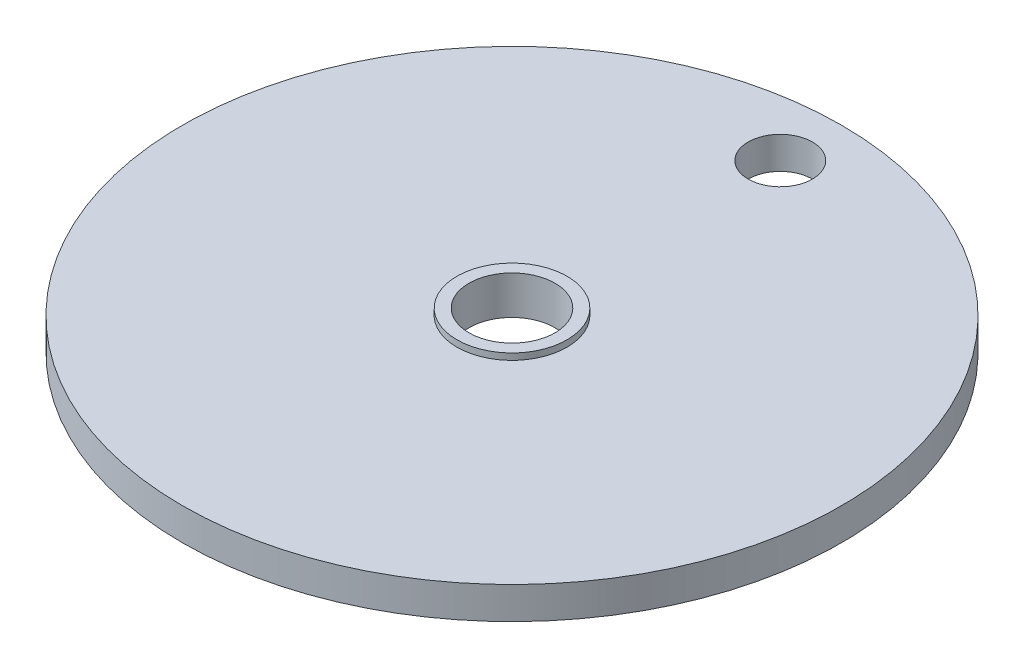
from build123d import *

# Parameters (mm, degrees)
SKETCH1_R           = 20.5
BOSS_EXTRUDE1_DEPTH = 2
SKETCH2_R           = 2.675
CUT_EXTRUDE1_DEPTH  = 2
BOSS_EXTRUDE2_START = 0.4
SKETCH3_R           = 3.425
SKETCH3_R_2         = 2.675
BOSS_EXTRUDE2_DEPTH = 0.4
SKETCH4_R           = 2
CUT_EXTRUDE2_DEPTH  = 2


with BuildPart() as part:
    # Sketch1 → Boss-Extrude1 (new body)
    with BuildSketch(Plane(origin=(0, 0, 0), x_dir=(1, 0, 0), z_dir=(0, 1, 0))):
        with Locations(Location((0, 0, 0), (0, 0, 270))):
            Circle(SKETCH1_R)
    extrude(amount=BOSS_EXTRUDE1_DEPTH)

    # Sketch2 → Cut-Extrude1 (cut)
    with BuildSketch(Plane(origin=(0, 2, 0), x_dir=(1, 0, 0), z_dir=(0, 1, 0))):
        with Locations(Location((0, 0, 0), (0, 0, 270))):
            Circle(SKETCH2_R)
    extrude(amount=-CUT_EXTRUDE1_DEPTH, mode=Mode.SUBTRACT)

    # Sketch3 → Boss-Extrude2 (add)
    with BuildSketch(Plane(origin=(0, 2, 0), x_dir=(1, 0, 0), z_dir=(0, 1, 0)).offset(BOSS_EXTRUDE2_START)):
        with Locations(Location((0, 0, 0), (0, 0, 270))):
            Circle(SKETCH3_R)
        with Locations(Location((0, 0, 0), (0, 0, 270))):
            Circle(SKETCH3_R_2, mode=Mode.SUBTRACT)
    extrude(amount=-BOSS_EXTRUDE2_DEPTH)

    # Sketch4 → Cut-Extrude2 (cut)
    with BuildSketch(Plane(origin=(0, 2, 0), x_dir=(1, 0, 0), z_dir=(0, 1, 0))):
        with Locations(Location((0, 16.68859089, 0), (0, 0, 270))):
            Circle(SKETCH4_R)
    extrude(amount=-CUT_EXTRUDE2_DEPTH, mode=Mode.SUBTRACT)


solid = part.part
